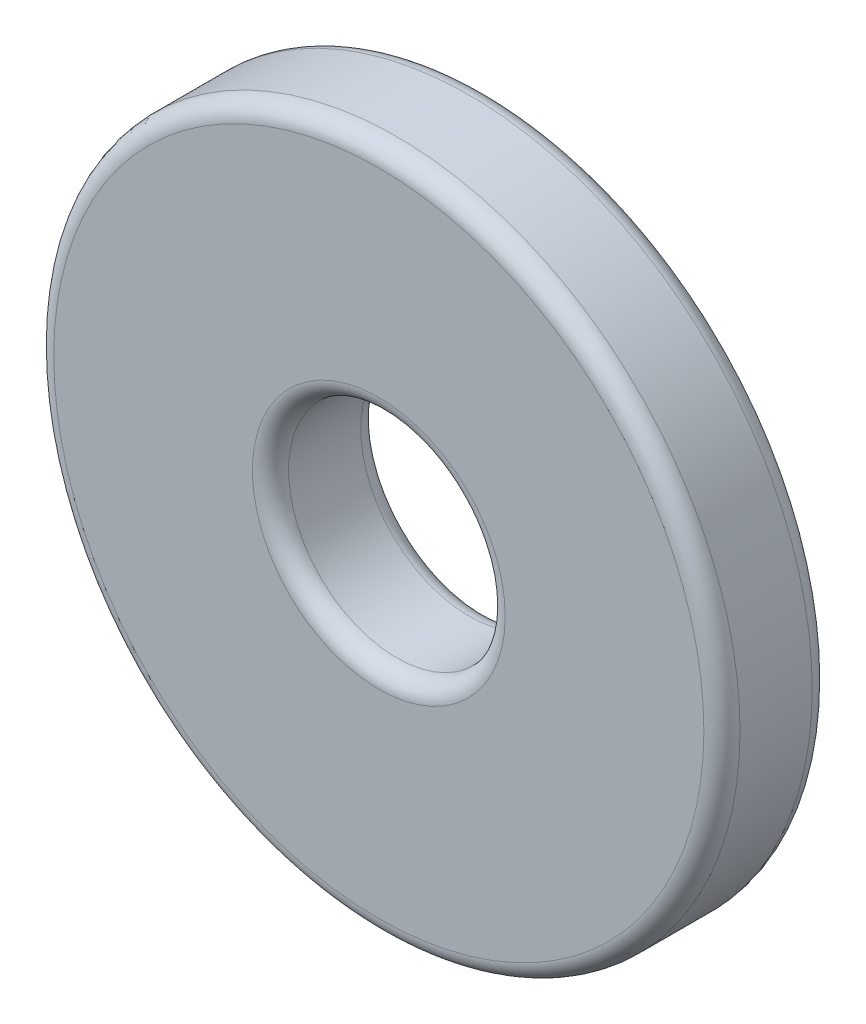
from build123d import *

# Parameters (mm, degrees)
ESBO_O1_R                = 9.5
ESBO_O1_R_2              = 3
RESSALTO_EXTRUS_O1_DEPTH = 1.5
FILETE1_R                = 0.5
FILETE2_R                = 0.5
FILETE3_R                = 0.5


with BuildPart() as part:
    # Esboço1 → Ressalto-extrusão1 (new, symmetric)
    with BuildSketch(Plane.XY):
        Circle(ESBO_O1_R)
        Circle(ESBO_O1_R_2, mode=Mode.SUBTRACT)
    extrude(amount=RESSALTO_EXTRUS_O1_DEPTH, both=True)

    # Filete1
    filete1_edges = [part.edges().sort_by_distance(p)[0] for p in [
        (-9.5, 0, 1.5),
    ]]
    fillet(filete1_edges, radius=FILETE1_R)

    # Filete2
    filete2_edges = [part.edges().sort_by_distance(p)[0] for p in [
        (-9.5, 0, -1.5),
    ]]
    fillet(filete2_edges, radius=FILETE2_R)

    # Filete3
    filete3_edges = [part.edges().sort_by_distance(p)[0] for p in [
        (-3, 0, -1.5),
        (-3, 0, 1.5),
    ]]
    fillet(filete3_edges, radius=FILETE3_R)


solid = part.part
